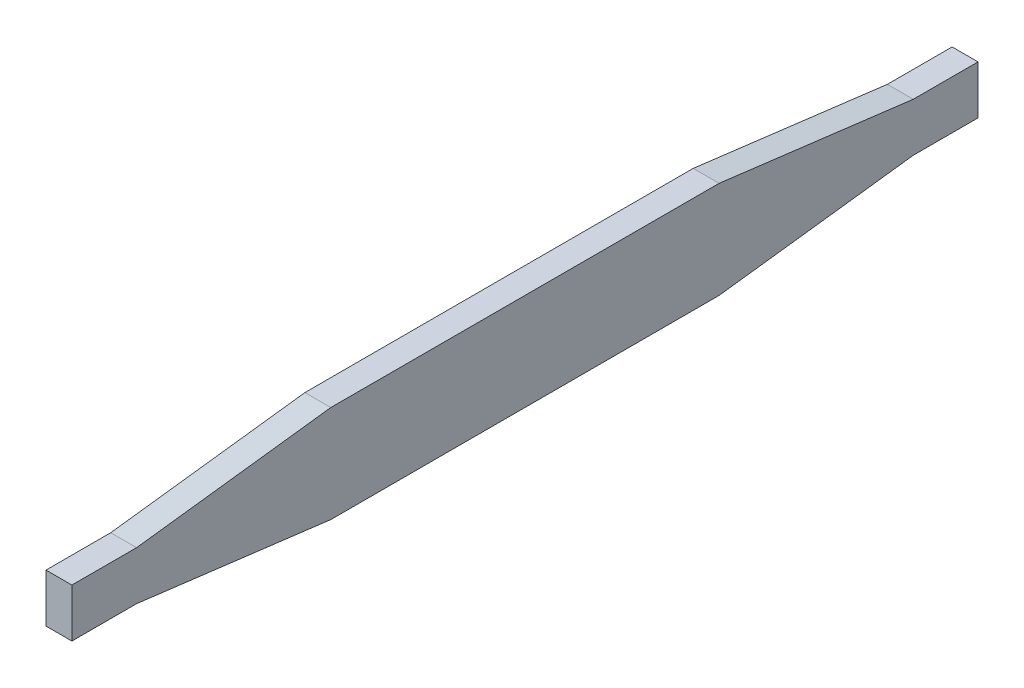
from build123d import *

# Parameters (mm, degrees)
SKETCH_1_W      = 60
SKETCH_1_H      = 15
SKETCH_1_W_2    = 10
SKETCH_1_H_2    = 7.5
EXTRUDE_1_DEPTH = 4


with BuildPart() as part:
    # Эскиз1 → Бобышка-Вытянуть1 (new body)
    with BuildSketch(Plane(origin=(0, 0, 0), x_dir=(0, 0, -1), z_dir=(1, 0, 0))):
        Rectangle(SKETCH_1_W, SKETCH_1_H)
        Polygon((-30, -7.5), (-30, 7.5), (-60, 3.75), (-60, -3.75), align=None)
        with Locations((-65, 0)):
            Rectangle(SKETCH_1_W_2, SKETCH_1_H_2)
        Polygon((60, -3.75), (30, -7.5), (30, 7.5), (60, 3.75), align=None)
        with Locations((65, 0)):
            Rectangle(SKETCH_1_W_2, SKETCH_1_H_2)
    extrude(amount=EXTRUDE_1_DEPTH)


solid = part.part
